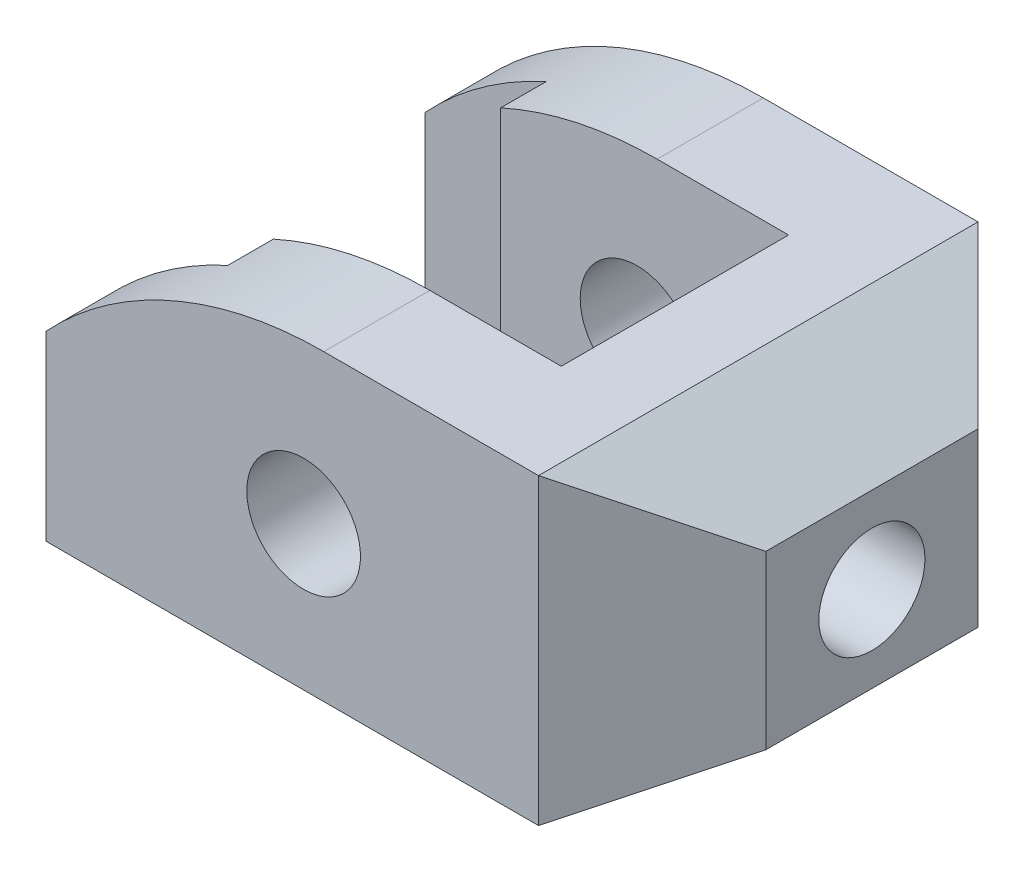
from build123d import *

# Parameters (mm, degrees)
SKETCH1_R               = 7.5
BOSS_EXTRUDE1_DEPTH     = 58
CUT_EXTRUDE1_DEPTH      = 90.381206078
CUT_EXTRUDE1_DEPTH_BACK = 90.381206078
CUT_EXTRUDE2_DEPTH      = 96.859271852
CUT_EXTRUDE2_DEPTH_BACK = 96.859271852
CUT_EXTRUDE3_DEPTH      = 107.60206377
CUT_EXTRUDE3_DEPTH_BACK = 107.60206377
SKETCH7_R               = 7


with BuildPart() as part:
    # Sketch1 → Boss-Extrude1 (new body)
    with BuildSketch(Plane.XY):
        with BuildLine():
            Line((0, 0), (-65, 0))
            Line((-65, 0), (-65, 24))
            ThreePointArc((-65, 24), (-48.33939444, 35.82575695), (-28.33939444, 40))
            Line((-28.33939444, 40), (0, 40))
            Line((0, 40), (15, 31.339745962))
            Line((15, 31.339745962), (15, 8.660254038))
            Line((15, 8.660254038), (0, 0))
        make_face()
        with Locations(Location((-31, 19, 0), (0, 0, 180))):
            Circle(SKETCH1_R, mode=Mode.SUBTRACT)
    extrude(amount=BOSS_EXTRUDE1_DEPTH)

    # Sketch3 → Cut-Extrude1 (cut, two sides: drawn at the far end of the back side and taken through both)
    with BuildSketch(Plane(origin=(0, 20, 0), x_dir=(1, 0, 0), z_dir=(0, 1, 0)).offset(-CUT_EXTRUDE1_DEPTH_BACK)):
        Polygon((-11, -44), (-11, -14), (-49, -14), (-49, -8), (-65, -8), (-65, -50), (-49, -50), (-49, -44), align=None)
    extrude(amount=CUT_EXTRUDE1_DEPTH + CUT_EXTRUDE1_DEPTH_BACK, mode=Mode.SUBTRACT)

    # Sketch6 → Cut-Extrude2 (cut, two sides: drawn at the far end of the back side and taken through both)
    with BuildSketch(Plane(origin=(0, 0, 0), x_dir=(1, 0, 0), z_dir=(0, 1, 0)).offset(-CUT_EXTRUDE2_DEPTH_BACK)):
        Polygon((0, 0), (15, -15), (15, 0), align=None)
        Polygon((15, -58), (15, -43), (0, -58), align=None)
    extrude(amount=CUT_EXTRUDE2_DEPTH + CUT_EXTRUDE2_DEPTH_BACK, mode=Mode.SUBTRACT)

    # Sketch7 → Cut-Extrude3 (cut, two sides: drawn at the far end of the back side and taken through both)
    with BuildSketch(Plane(origin=(15, 0, 0), x_dir=(0, 0, -1), z_dir=(1, 0, 0)).offset(-CUT_EXTRUDE3_DEPTH_BACK)):
        with Locations(Location((-29, 20, 0), (0, 0, 90))):
            Circle(SKETCH7_R)
    extrude(amount=CUT_EXTRUDE3_DEPTH + CUT_EXTRUDE3_DEPTH_BACK, mode=Mode.SUBTRACT)


solid = part.part
